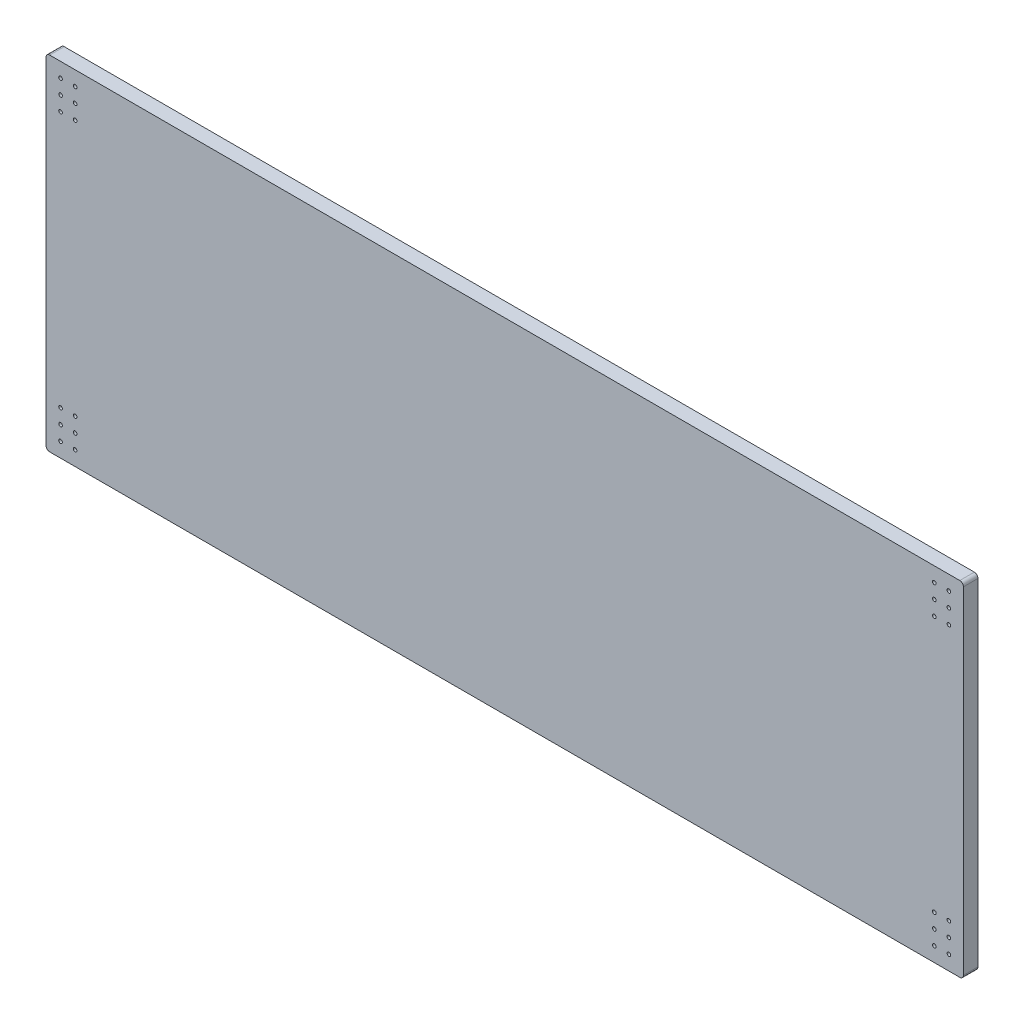
from build123d import *

# Parameters (mm, degrees)
SKETCH1_W               = 1600.2
SKETCH1_H               = 599.44
BOSS_EXTRUDE1_DEPTH     = 25.4
FILLET1_R               = 6.35
SKETCH2_R               = 3.175
CUT_EXTRUDE1_DEPTH      = 6.35
MIRROR2_COPY_1_SKETCH_R = 3.175
MIRROR2_COPY_1_DEPTH    = 6.35


with BuildPart() as part:
    # Sketch1 → Boss-Extrude1 (new body)
    with BuildSketch(Plane.XY):
        Rectangle(SKETCH1_W, SKETCH1_H)
    extrude(amount=BOSS_EXTRUDE1_DEPTH)

    # Fillet1
    fillet1_edges = [part.edges().sort_by_distance(p)[0] for p in [
        (800.1, 299.72, 12.7),
        (800.1, -299.72, 12.7),
        (-800.1, -299.72, 12.7),
        (-800.1, 299.72, 12.7),
    ]]
    fillet(fillet1_edges, radius=FILLET1_R)

    # Sketch2 → Cut-Extrude1 (cut)
    with BuildSketch(Plane.XY.offset(25.4)):
        with Locations((-774.7, 274.32)):
            Circle(SKETCH2_R)
        with Locations((-749.3, 274.32)):
            Circle(SKETCH2_R)
        with Locations((-749.3, 248.92)):
            Circle(SKETCH2_R)
        with Locations((-774.7, 248.92)):
            Circle(SKETCH2_R)
        with Locations((-749.3, 223.52)):
            Circle(SKETCH2_R)
        with Locations((-774.7, 223.52)):
            Circle(SKETCH2_R)
    cut_extrude1 = extrude(amount=-CUT_EXTRUDE1_DEPTH, mode=Mode.SUBTRACT)

    # Mirror1: Cut-Extrude1 across plane
    add(cut_extrude1.mirror(Plane.ZX), mode=Mode.SUBTRACT)

    # Mirror2: Cut-Extrude1 across plane
    add(cut_extrude1.mirror(Plane(origin=(0, 0, 0), x_dir=(0, 0, 1), z_dir=(1, 0, 0))), mode=Mode.SUBTRACT)

    # Mirror2 copy 1 sketch → Mirror2 copy 1 (cut)
    with BuildSketch(Plane(origin=(0, 0, 25.4), x_dir=(-1, 0, 0), z_dir=(0, 0, 1))):
        with Locations((-774.7, 274.32)):
            Circle(MIRROR2_COPY_1_SKETCH_R)
        with Locations((-749.3, 274.32)):
            Circle(MIRROR2_COPY_1_SKETCH_R)
        with Locations((-749.3, 248.92)):
            Circle(MIRROR2_COPY_1_SKETCH_R)
        with Locations((-774.7, 248.92)):
            Circle(MIRROR2_COPY_1_SKETCH_R)
        with Locations((-749.3, 223.52)):
            Circle(MIRROR2_COPY_1_SKETCH_R)
        with Locations((-774.7, 223.52)):
            Circle(MIRROR2_COPY_1_SKETCH_R)
    extrude(amount=-MIRROR2_COPY_1_DEPTH, mode=Mode.SUBTRACT)


solid = part.part
